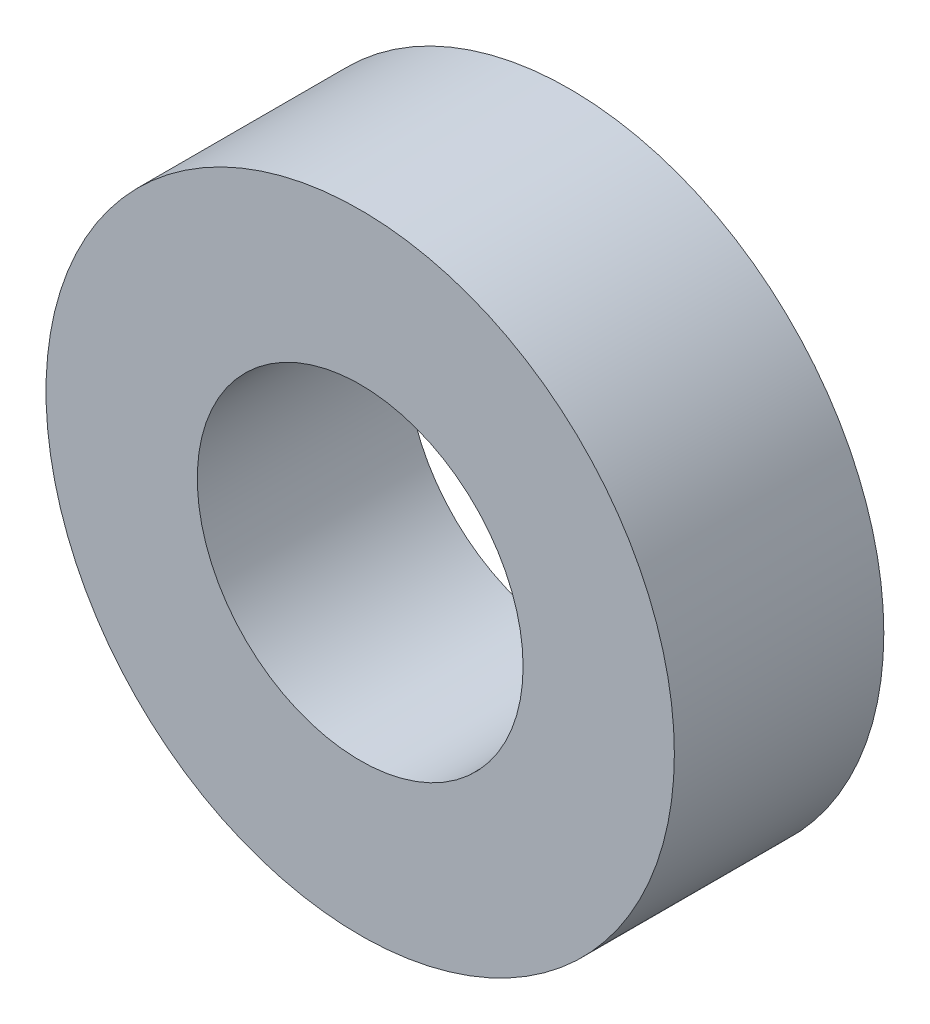
from build123d import *

# Parameters (mm, degrees)
SKETCH_1_R      = 13.5
SKETCH_1_R_2    = 7
EXTRUDE_1_DEPTH = 9


with BuildPart() as part:
    # Эскиз1 → Бобышка-Вытянуть1 (new body)
    with BuildSketch(Plane.XY):
        Circle(SKETCH_1_R)
        Circle(SKETCH_1_R_2, mode=Mode.SUBTRACT)
    extrude(amount=EXTRUDE_1_DEPTH)


solid = part.part
